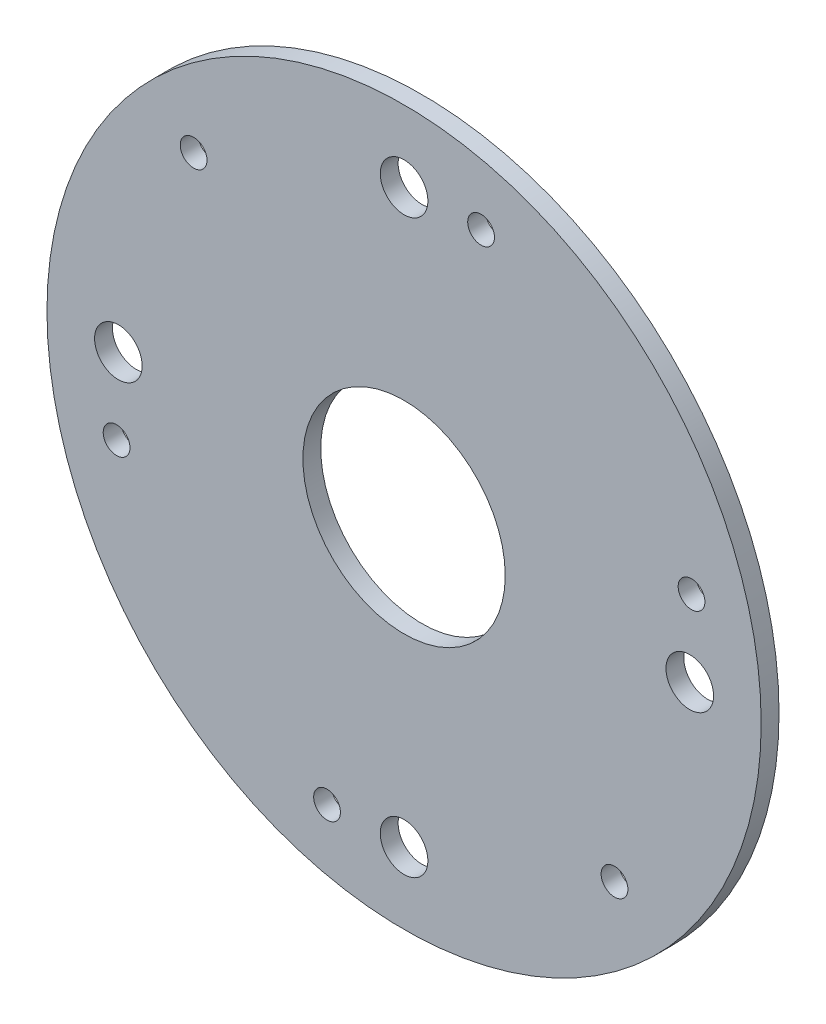
from build123d import *

# Parameters (mm, degrees)
CARRIER_FRONT_START = 55.5
SKETCH_1_R          = 60
SKETCH_1_R_2        = 17
CARRIER_FRONT_DEPTH = 3
SKETCH_2_R          = 2.25
THROUGH_HOLES_DEPTH = 100
SKETCH_3_R          = 4
CUT_EXTRUDE_2_DEPTH = 100


with BuildPart() as part:
    # Эскиз1 → Carrier_front (new body)
    with BuildSketch(Plane.XY.offset(CARRIER_FRONT_START)):
        Circle(SKETCH_1_R)
        Circle(SKETCH_1_R_2, mode=Mode.SUBTRACT)
    extrude(amount=CARRIER_FRONT_DEPTH)

    # Эскиз2 → Through_holes (cut, symmetric)
    with BuildSketch(Plane.XY):
        with Locations((48, 0)):
            Circle(SKETCH_2_R)
        with Locations((0, 48)):
            Circle(SKETCH_2_R)
        with Locations((-48, 0)):
            Circle(SKETCH_2_R)
        with Locations((0, -48)):
            Circle(SKETCH_2_R)
        with Locations((48.296291314, 12.940952255)):
            Circle(SKETCH_2_R)
        with Locations((12.940952255, 48.296291314)):
            Circle(SKETCH_2_R)
        with Locations((-35.355339059, 35.355339059)):
            Circle(SKETCH_2_R)
        with Locations((-48.296291314, -12.940952255)):
            Circle(SKETCH_2_R)
        with Locations((-12.940952255, -48.296291314)):
            Circle(SKETCH_2_R)
        with Locations((35.355339059, -35.355339059)):
            Circle(SKETCH_2_R)
    extrude(amount=THROUGH_HOLES_DEPTH, both=True, mode=Mode.SUBTRACT)

    # Эскиз3 → Вырез-Вытянуть2 (cut, symmetric)
    with BuildSketch(Plane.XY):
        with Locations((48, 0)):
            Circle(SKETCH_3_R)
        with Locations((0, 48)):
            Circle(SKETCH_3_R)
        with Locations((-48, 0)):
            Circle(SKETCH_3_R)
        with Locations((0, -48)):
            Circle(SKETCH_3_R)
    extrude(amount=CUT_EXTRUDE_2_DEPTH, both=True, mode=Mode.SUBTRACT)


solid = part.part
